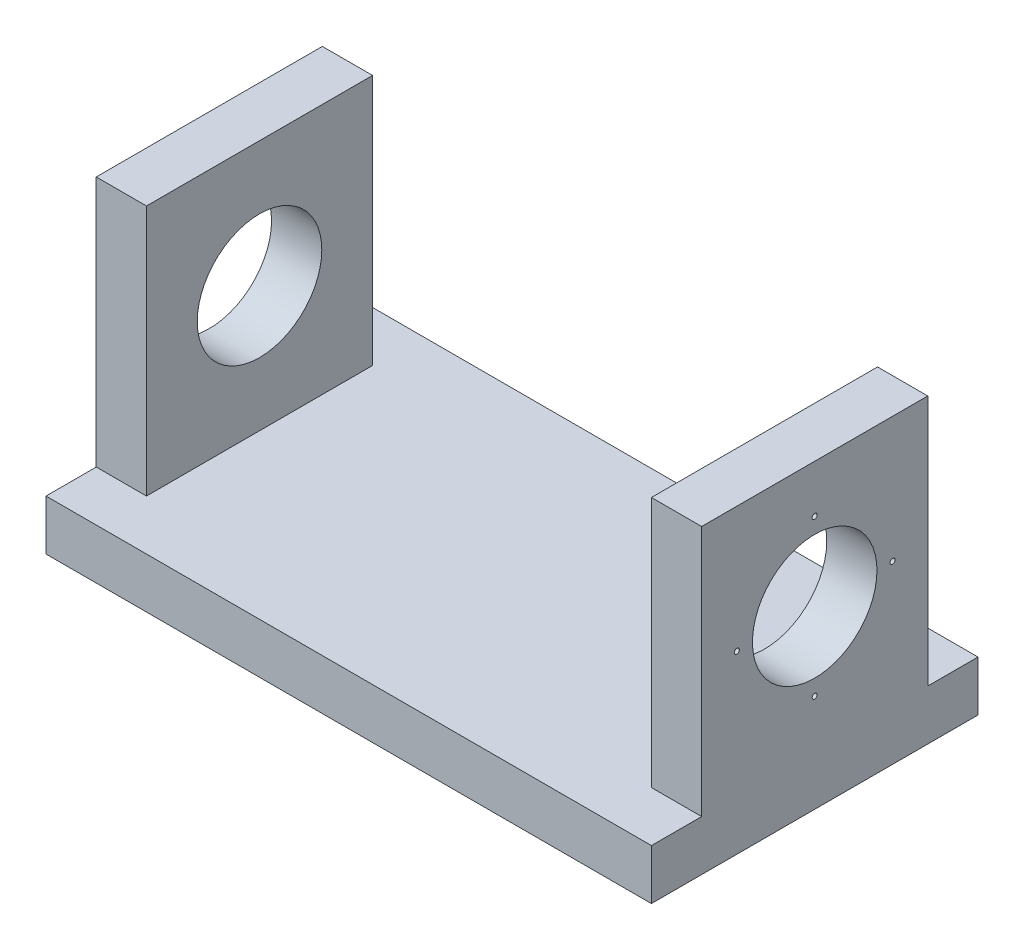
from build123d import *

# Parameters (mm, degrees)
SKETCH5_W               = 241
SKETCH5_H               = 130
BOSS_EXTRUDE2_DEPTH     = 20
SKETCH6_W               = 20
SKETCH6_H               = 90
BOSS_EXTRUDE3_DEPTH     = 100
CUT_EXTRUDE1_DEPTH      = 269.897750084
CUT_EXTRUDE1_DEPTH_BACK = 269.897750084
SKETCH8_R               = 24.784776311
SKETCH9_R               = 15.5
CUT_EXTRUDE2_DEPTH      = 10
SKETCH10_R              = 1
CUT_EXTRUDE3_DEPTH      = 20


with BuildPart() as part:
    # Sketch5 → Boss-Extrude2 (new body)
    with BuildSketch(Plane(origin=(0, 0, 0), x_dir=(1, 0, 0), z_dir=(0, 1, 0))):
        Rectangle(SKETCH5_W, SKETCH5_H)
    extrude(amount=-BOSS_EXTRUDE2_DEPTH)

    # Sketch6 → Boss-Extrude3 (add)
    with BuildSketch(Plane(origin=(0, 0, 0), x_dir=(1, 0, 0), z_dir=(0, 1, 0))):
        with Locations((110.5, 0)):
            Rectangle(SKETCH6_W, SKETCH6_H)
        with Locations((-110.5, 0)):
            Rectangle(SKETCH6_W, SKETCH6_H)
    extrude(amount=BOSS_EXTRUDE3_DEPTH)

    # Sketch8 → Cut-Extrude1 (cut, two sides: drawn at the far end of the back side and taken through both)
    with BuildSketch(Plane(origin=(120.5, 0, 0), x_dir=(0, 0, -1), z_dir=(1, 0, 0)).offset(-CUT_EXTRUDE1_DEPTH_BACK)):
        with Locations((0, 50)):
            Circle(SKETCH8_R)
    extrude(amount=CUT_EXTRUDE1_DEPTH + CUT_EXTRUDE1_DEPTH_BACK, mode=Mode.SUBTRACT)

    # Sketch9 → Cut-Extrude2 (cut)
    with BuildSketch(Plane.XZ.offset(20)):
        with Locations(Location((0, 0, 0), (0, 0, 270))):
            Circle(SKETCH9_R)
    extrude(amount=-CUT_EXTRUDE2_DEPTH, mode=Mode.SUBTRACT)

    # Sketch10 → Cut-Extrude3 (cut)
    with BuildSketch(Plane(origin=(120.5, 0, 0), x_dir=(0, 0, -1), z_dir=(1, 0, 0))):
        with Locations((0, 81)):
            Circle(SKETCH10_R)
        with Locations((-31, 50)):
            Circle(SKETCH10_R)
        with Locations((31, 50)):
            Circle(SKETCH10_R)
        with Locations((0, 19)):
            Circle(SKETCH10_R)
    extrude(amount=-CUT_EXTRUDE3_DEPTH, mode=Mode.SUBTRACT)


solid = part.part
